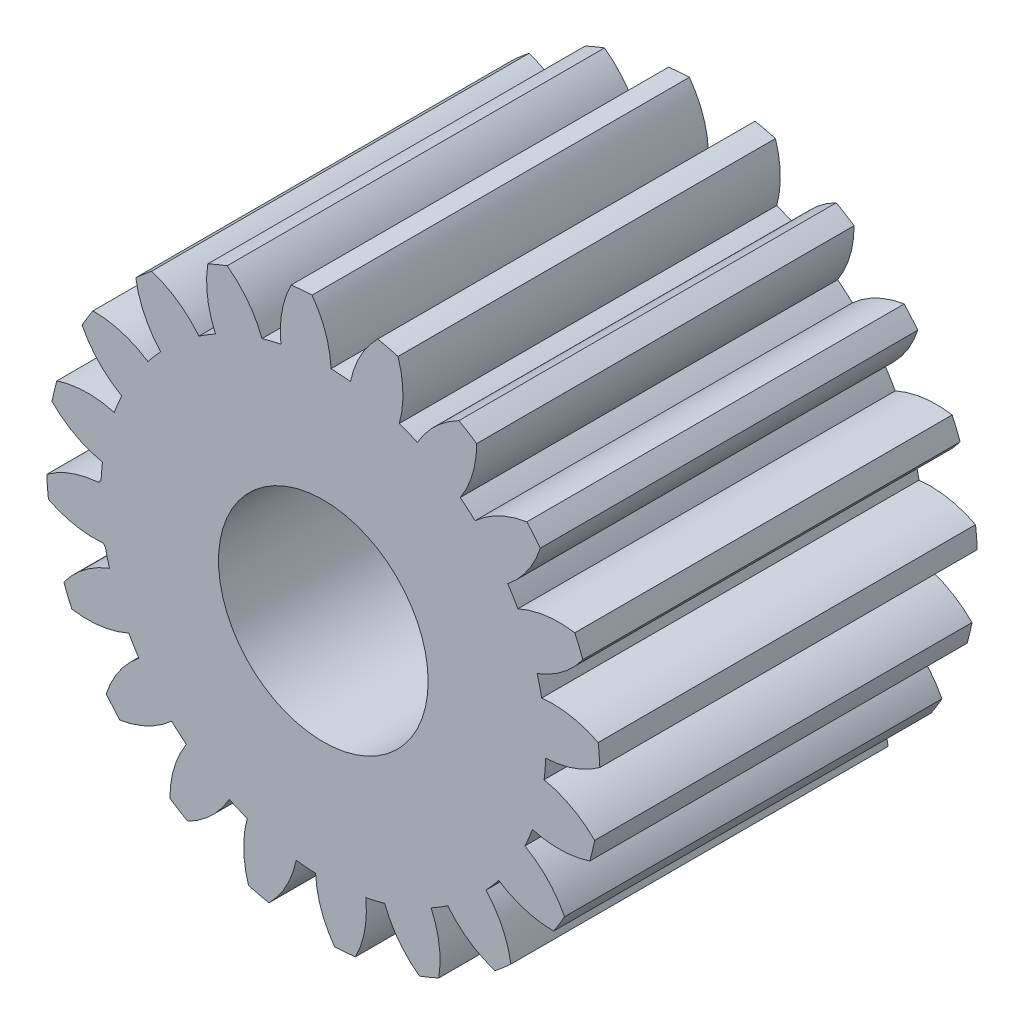
from build123d import *

# Parameters (mm, degrees)
BOSS_EXTRUDE3_DEPTH = 45
SKETCH2_R           = 26.528775
BOSS_EXTRUDE4_DEPTH = 45
FILLET1_R           = 0.5
FILLET3_R           = 0.5
CIRPATTERN1_COUNT   = 20
SKETCH6_R           = 12.5
CUT_EXTRUDE1_DEPTH  = 45


with BuildPart() as part:
    # Sketch5 → Boss-Extrude3 (new body)
    with BuildSketch(Plane.XY):
        with BuildLine():
            ThreePointArc((-26.512738687, 0.922274544), (-29.909251863, 0.264692013), (-32.972666572, -1.342854834))
            ThreePointArc((-32.972666572, -1.342854834), (-32.898272013, -2.589150159), (-32.776787109, -3.831739394))
            ThreePointArc((-32.776787109, -3.831739394), (-29.499612388, -4.94027103), (-26.042047353, -5.058425907))
            ThreePointArc((-26.042047353, -5.058425907), (-26.44699564, -2.081423697), (-26.512738687, 0.922274544))
        make_face()
    boss_extrude3 = extrude(amount=BOSS_EXTRUDE3_DEPTH)

    # Sketch2 → Boss-Extrude4 (add)
    with BuildSketch(Plane.XY):
        Circle(SKETCH2_R)
    extrude(amount=BOSS_EXTRUDE4_DEPTH)

    # Fillet1
    fillet1_edges = [part.edges().sort_by_distance(p)[0] for p in [
        (-26.512738687, 0.922274544, 22.5),
    ]]
    fillet(fillet1_edges, radius=FILLET1_R)

    # Fillet3
    fillet3_edges = [part.edges().sort_by_distance(p)[0] for p in [
        (-26.042047353, -5.058425907, 22.5),
    ]]
    fillet(fillet3_edges, radius=FILLET3_R)

    # CirPattern1: Boss-Extrude3 ×20 about axis
    cirpattern1_axis = Axis((0, 0, 0), (0, 0, 1))
    for i in range(1, CIRPATTERN1_COUNT):
        add(boss_extrude3.rotate(cirpattern1_axis, i * 360 / CIRPATTERN1_COUNT))

    # Sketch6 → Cut-Extrude1 (cut)
    with BuildSketch(Plane.XY.offset(45)):
        Circle(SKETCH6_R)
    extrude(amount=-CUT_EXTRUDE1_DEPTH, mode=Mode.SUBTRACT)


solid = part.part
